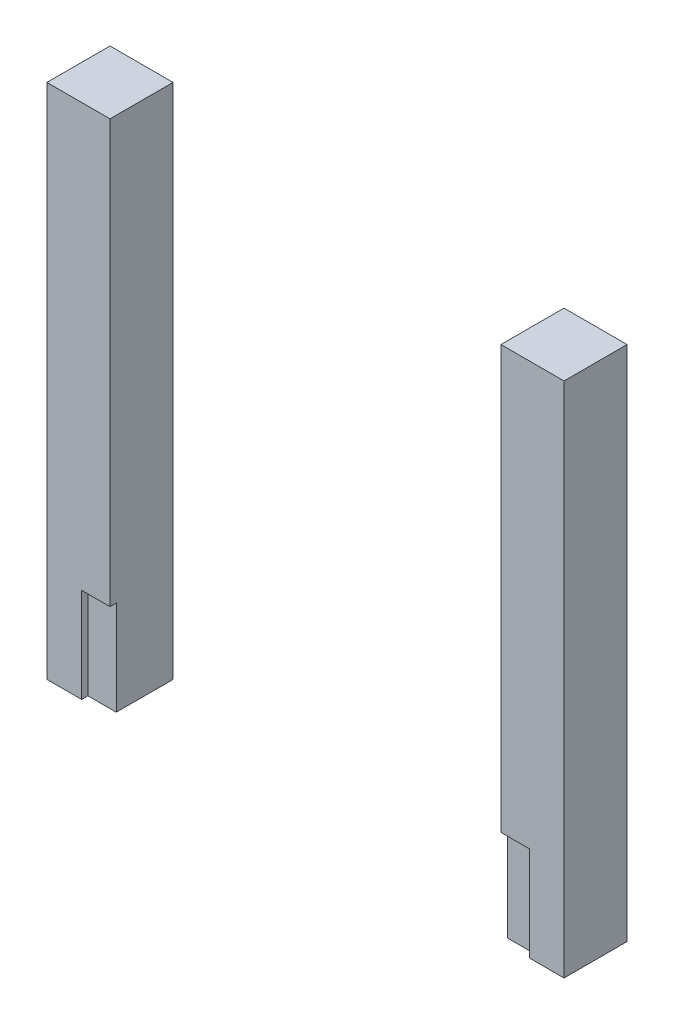
from build123d import *

# Parameters (mm, degrees)
SKETCH1_W           = 820
SKETCH1_H           = 820
SKETCH1_W_2         = 620
SKETCH1_H_2         = 620
BOSS_EXTRUDE1_DEPTH = 50
SKETCH2_W           = 710
SKETCH2_H           = 150
CUT_EXTRUDE1_DEPTH  = 10
SKETCH3_W           = 620
SKETCH3_H           = 100
CUT_EXTRUDE2_DEPTH  = 589.387627334


with BuildPart() as part:
    # Sketch1 → Boss-Extrude1 (new, symmetric)
    with BuildSketch(Plane.XY):
        Rectangle(SKETCH1_W, SKETCH1_H)
        Rectangle(SKETCH1_W_2, SKETCH1_H_2, mode=Mode.SUBTRACT)
    extrude(amount=BOSS_EXTRUDE1_DEPTH, both=True)

    # Sketch2 → Cut-Extrude1 (cut)
    with BuildSketch(Plane.XY.offset(50)):
        with Locations((0, -335)):
            Rectangle(SKETCH2_W, SKETCH2_H)
    extrude(amount=-CUT_EXTRUDE1_DEPTH, mode=Mode.SUBTRACT)

    # Sketch3 → Cut-Extrude2 (cut, through all)
    with BuildSketch(Plane(origin=(0, 0, -50), x_dir=(-1, 0, 0), z_dir=(0, 0, -1))):
        with Locations((0, -360)):
            Rectangle(SKETCH3_W, SKETCH3_H)
        with Locations((0, 360)):
            Rectangle(SKETCH3_W, SKETCH3_H)
    extrude(amount=-CUT_EXTRUDE2_DEPTH, mode=Mode.SUBTRACT)


with BuildPart() as cut_extrude2_piece_1:
    # of the separate pieces the step leaves, piece 1, a body of its own (cut_extrude2_pieces)
    add(part.part.solids().sort_by_distance((-410, 410, -50))[0])


with BuildPart() as cut_extrude2_piece_2:
    # of the separate pieces the step leaves, piece 2, a body of its own (cut_extrude2_pieces)
    add(part.part.solids().sort_by_distance((310, 410, -50))[0])


solid = Compound([cut_extrude2_piece_1.part, cut_extrude2_piece_2.part])
